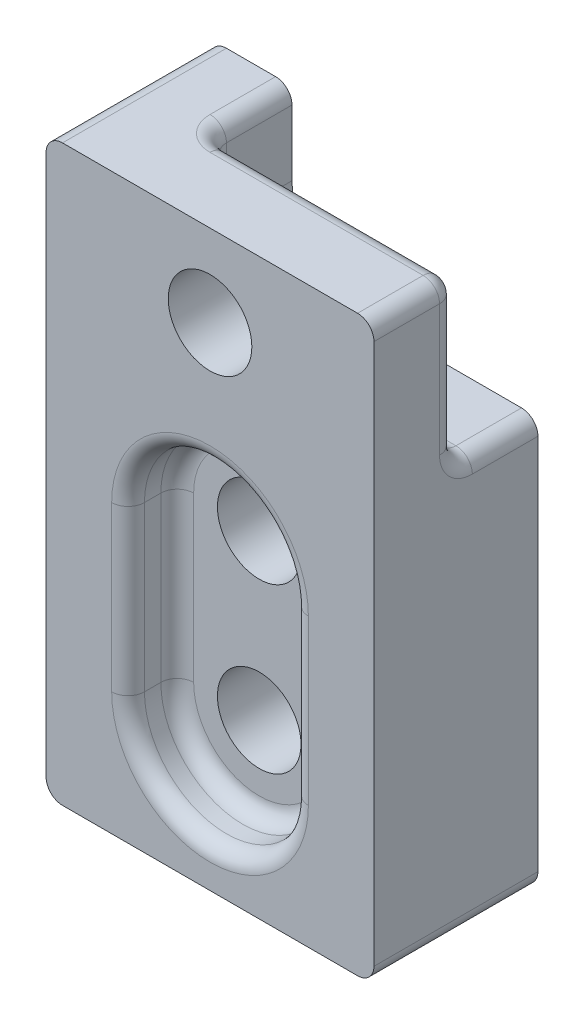
from build123d import *

# Parameters (mm, degrees)
SKETCH1_W           = 20
SKETCH1_H           = 35
SKETCH1_R           = 2.55
BOSS_EXTRUDE1_DEPTH = 10
CUT_EXTRUDE1_DEPTH  = 5
SKETCH3_R           = 2.55
CUT_EXTRUDE2_DEPTH  = 23.5
CUT_EXTRUDE4_START  = 10
CUT_EXTRUDE4_DEPTH  = 3
FILLET1_R           = 1


with BuildPart() as part:
    # Sketch1 → Boss-Extrude1 (new body)
    with BuildSketch(Plane.XY):
        Rectangle(SKETCH1_W, SKETCH1_H)
        with Locations((0, -10)):
            Circle(SKETCH1_R, mode=Mode.SUBTRACT)
        Circle(SKETCH1_R, mode=Mode.SUBTRACT)
    extrude(amount=BOSS_EXTRUDE1_DEPTH)

    # Sketch2 → Cut-Extrude1 (cut)
    with BuildSketch(Plane.XY):
        with BuildLine():
            Line((-5, 12.5), (-5, 17.5))
            Line((-5, 17.5), (10, 17.5))
            Line((10, 17.5), (10, 7.5))
            Line((10, 7.5), (0, 7.5))
            ThreePointArc((0, 7.5), (-3.535533906, 8.964466094), (-5, 12.5))
        make_face()
    extrude(amount=CUT_EXTRUDE1_DEPTH, mode=Mode.SUBTRACT)

    # Sketch3 → Cut-Extrude2 (cut, through all)
    with BuildSketch(Plane.XY):
        with Locations((0, 12.5)):
            Circle(SKETCH3_R)
    extrude(amount=CUT_EXTRUDE2_DEPTH, mode=Mode.SUBTRACT)

    # Sketch4 → Cut-Extrude4 (cut)
    with BuildSketch(Plane.XY.offset(CUT_EXTRUDE4_START)):
        with BuildLine():
            Line((-5, -10), (-5, 0))
            ThreePointArc((-5, 0), (0, 5), (5, 0))
            Line((5, 0), (5, -10))
            ThreePointArc((5, -10), (0, -15), (-5, -10))
        make_face()
    extrude(amount=-CUT_EXTRUDE4_DEPTH, mode=Mode.SUBTRACT)

    # Fillet1
    fillet1_edges = [part.edges().sort_by_distance(p)[0] for p in [
        (10, 7.5, 2.5),
        (-5, 17.5, 2.5),
        (-3.535533906, 8.964466094, 5),
        (5, 7.5, 5),
        (10, 12.5, 5),
        (2.5, 17.5, 5),
        (-5, 15, 5),
        (-5, -5, 10),
        (0, 5, 7),
        (5, -5, 10),
        (0, -15, 7),
        (-5, -5, 7),
        (5, -5, 7),
        (0, -15, 10),
        (0, 5, 10),
        (10, 17.5, 7.5),
        (10, -17.5, 5),
        (-10, -17.5, 5),
        (-10, 17.5, 5),
    ]]
    fillet(fillet1_edges, radius=FILLET1_R)


solid = part.part
